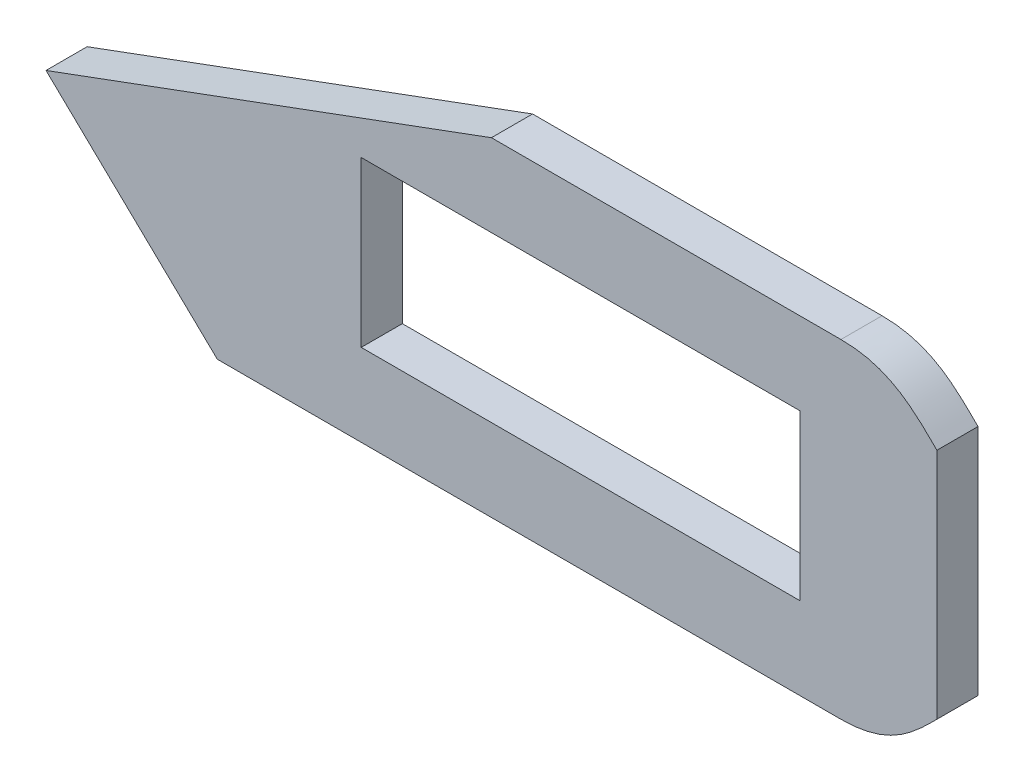
from build123d import *

# Parameters (mm, degrees)
ESQUISSE1_W        = 32
ESQUISSE1_H        = 12
BOSS_EXTRU_1_DEPTH = 3


with BuildPart() as part:
    # Esquisse1 → Boss.-Extru.1 (new body)
    with BuildSketch(Plane.XY):
        with BuildLine():
            Line((-1.901457503, 12), (-34.401457503, 0))
            Line((-34.401457503, 0), (-21.901457503, -12))
            Line((-21.901457503, -12), (23.598542497, -12))
            add(Edge.make_bspline(
                [(23.598542497, -12), (27.098542497, -12), (28.848542497, -10.25), (30.598542497, -8.5)],
                knots=[0, 0, 0, 0, 0.5, 0.5, 0.5, 0.5], degree=3))
            Line((30.598542497, -8.5), (30.598542497, 8.5))
            add(Edge.make_bspline(
                [(23.598542497, 12), (27.098542497, 12), (28.848542497, 10.25), (30.598542497, 8.5)],
                knots=[0, 0, 0, 0, 0.5, 0.5, 0.5, 0.5], degree=3))
            Line((23.598542497, 12), (-1.901457503, 12))
        make_face()
        with Locations((4.598542497, 0)):
            Rectangle(ESQUISSE1_W, ESQUISSE1_H, mode=Mode.SUBTRACT)
    extrude(amount=BOSS_EXTRU_1_DEPTH)


solid = part.part
